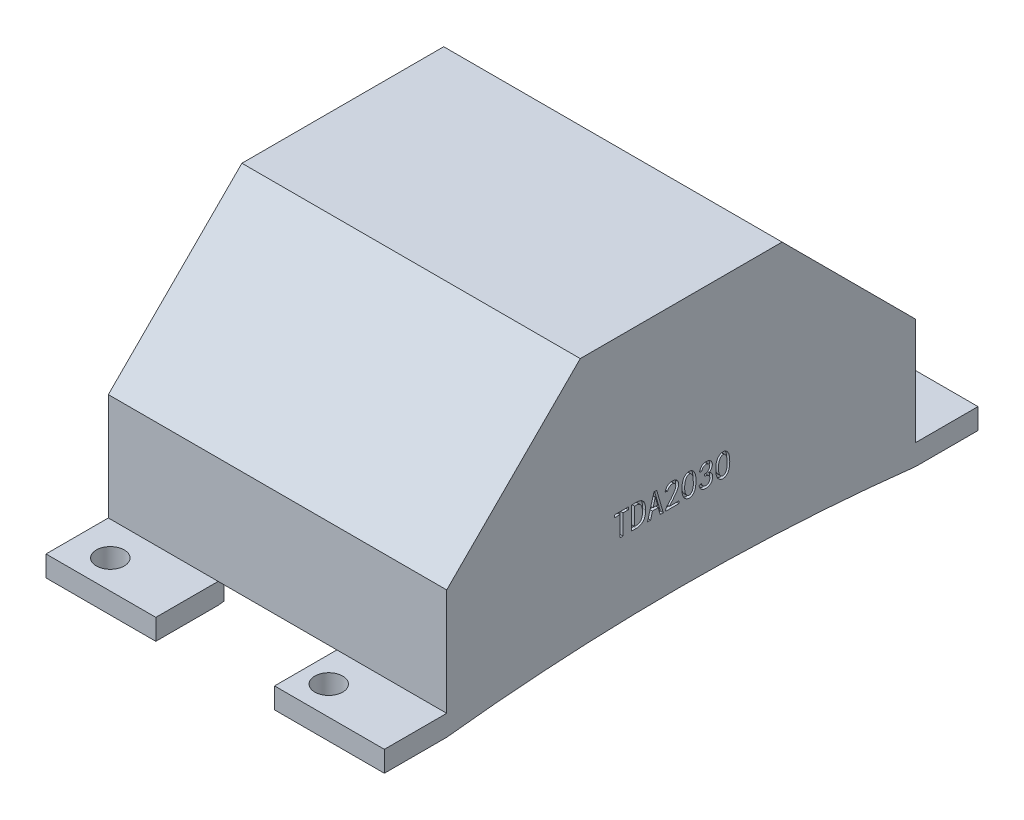
from build123d import *

# Parameters (mm, degrees)
EXTRUDE_1_DEPTH     = 100
SKETCH_2_R          = 2.35
CUT_EXTRUDE_1_DEPTH = 113.90814851
CUT_EXTRUDE_3_DEPTH = 118.187883333
SKETCH_9_W          = 51
SKETCH_9_H          = 77
CUT_EXTRUDE_4_DEPTH = 9
SKETCH_5_W          = 57
SKETCH_5_H          = 18
EXTRUDE_2_DEPTH     = 1
SKETCH_6_W          = 57
SKETCH_6_H          = 31.819805153
EXTRUDE_3_DEPTH     = 1
SKETCH_7_W          = 57
SKETCH_7_H          = 18
EXTRUDE_4_DEPTH     = 1
SKETCH_8_W          = 57
SKETCH_8_H          = 31.819805154
EXTRUDE_5_DEPTH     = 1
CUT_EXTRUDE_5_DEPTH = 0.5


with BuildPart() as part:
    # 草图1 → 凸台-拉伸1 (new body)
    with BuildSketch(Plane.XY):
        Polygon((-10, -18.5), (-10, -22), (-28.5, -22), (-28.5, 22), (28.5, 22), (28.5, -22), (10, -22), (10, -18.5), (25.5, -18.5), (25.5, 20), (-25.5, 20), (-25.5, -18.5), align=None)
    extrude(amount=EXTRUDE_1_DEPTH)

    # 草图2 → 切除-拉伸1 (cut, through all)
    with BuildSketch(Plane.XZ.offset(22)):
        with Locations(Location((-22.5, 95.17, 0), (0, 0, 270))):
            Circle(SKETCH_2_R)
        with Locations(Location((14.3, 95.17, 0), (0, 0, 270))):
            Circle(SKETCH_2_R)
        with Locations(Location((14.3, 4.83, 0), (0, 0, 270))):
            Circle(SKETCH_2_R)
        with Locations(Location((-22.5, 4.83, 0), (0, 0, 270))):
            Circle(SKETCH_2_R)
    extrude(amount=-CUT_EXTRUDE_1_DEPTH, mode=Mode.SUBTRACT)

    # 草图3 → 切除-拉伸3 (cut, through all)
    with BuildSketch(Plane(origin=(28.5, 0, 0), x_dir=(0, 0, -1), z_dir=(1, 0, 0))):
        with BuildLine():
            Line((-89.5, -22), (-10.5, -22))
            ThreePointArc((-10.5, -22), (-50, -19.748443616), (-89.5, -22))
        make_face()
        Polygon((-100, 22), (-67, 22), (-89.5, -0.5), (-89.5, -18.5), (-100, -18.5), align=None)
        Polygon((0, 22), (-33, 22), (-10.5, -0.5), (-10.5, -18.5), (0, -18.5), align=None)
    extrude(amount=-CUT_EXTRUDE_3_DEPTH, mode=Mode.SUBTRACT)

    # 草图9 → 切除-拉伸4 (cut)
    with BuildSketch(Plane.XZ.offset(22)):
        with Locations((0, 50)):
            Rectangle(SKETCH_9_W, SKETCH_9_H)
    extrude(amount=-CUT_EXTRUDE_4_DEPTH, mode=Mode.SUBTRACT)

    # 草图5 → 凸台-拉伸2 (add)
    with BuildSketch(Plane(origin=(0, 0, 10.5), x_dir=(-1, 0, 0), z_dir=(0, 0, -1))):
        with Locations((0, -9.5)):
            Rectangle(SKETCH_5_W, SKETCH_5_H)
    extrude(amount=-EXTRUDE_2_DEPTH)

    # 草图6 → 凸台-拉伸3 (add)
    with BuildSketch(Plane(origin=(0, -5.5, 5.5), x_dir=(1, 0, 0), z_dir=(0, 0.7071067811865498, -0.7071067811865452))):
        with Locations((0, -22.980970389)):
            Rectangle(SKETCH_6_W, SKETCH_6_H)
    extrude(amount=-EXTRUDE_3_DEPTH)

    # 草图7 → 凸台-拉伸4 (add)
    with BuildSketch(Plane.XY.offset(89.5)):
        with Locations((0, -9.5)):
            Rectangle(SKETCH_7_W, SKETCH_7_H)
    extrude(amount=-EXTRUDE_4_DEPTH)

    # 草图8 → 凸台-拉伸5 (add)
    with BuildSketch(Plane(origin=(0, 44.5, 44.5), x_dir=(1, 0, 0), z_dir=(0, 0.7071067811865485, 0.7071067811865467))):
        with Locations((0, -47.72970773)):
            Rectangle(SKETCH_8_W, SKETCH_8_H)
    extrude(amount=-EXTRUDE_5_DEPTH)

    # 草图11 → 切除-拉伸5 (cut)
    # profile 1 of 7: a face of its own
    with BuildSketch(Plane(origin=(28.5, 0, 0), x_dir=(0, 0, -1), z_dir=(1, 0, 0))):
        with BuildLine():
            add(Edge.make_bspline(
                [(-49.859858376, -5.342714269), (-49.857742239, -5.294955358), (-49.853614897, -5.201805772), (-49.841690154, -5.065983168), (-49.827289812, -4.937438516), (-49.808567465, -4.816564935), (-49.785427588, -4.703764752), (-49.75923609, -4.598446801), (-49.728967687, -4.500905762), (-49.684398102, -4.381779592), (-49.617563882, -4.244666812), (-49.521964843, -4.093970043), (-49.410875583, -3.958504245), (-49.30578161, -3.859244023), (-49.214658026, -3.789384215), (-49.141852018, -3.744026504), (-49.065362425, -3.705271755), (-48.984938406, -3.673666443), (-48.900727853, -3.65012353), (-48.812953864, -3.632742045), (-48.721326753, -3.621989594), (-48.626909526, -3.618790607), (-48.53178085, -3.623269771), (-48.438330549, -3.637861626), (-48.34815264, -3.663765899), (-48.261185547, -3.699328374), (-48.177665951, -3.745021747), (-48.097173432, -3.800478984), (-48.020662254, -3.867134279), (-47.947178828, -3.942281104), (-47.878543157, -4.024986166), (-47.815673035, -4.113653315), (-47.758829626, -4.207367964), (-47.708770604, -4.306644238), (-47.663898635, -4.410606732), (-47.626255042, -4.520181468), (-47.595111462, -4.634923281), (-47.560817502, -4.797016218), (-47.530646252, -5.012028303), (-47.509390226, -5.284151394), (-47.504539926, -5.574310829), (-47.511762106, -5.825239334), (-47.525376083, -6.028549312), (-47.540853669, -6.176012569), (-47.561642751, -6.31596101), (-47.585843717, -6.449075841), (-47.616120589, -6.574649154), (-47.651999007, -6.692815497), (-47.690764029, -6.804346816), (-47.736392553, -6.908070748), (-47.786089176, -7.004868166), (-47.842747575, -7.09349914), (-47.90412904, -7.175160832), (-47.971860717, -7.249206105), (-48.046825053, -7.314143391), (-48.126413921, -7.373106155), (-48.212764745, -7.423290107), (-48.303576513, -7.465876078), (-48.397105797, -7.499769084), (-48.492184933, -7.521859543), (-48.587020301, -7.534989222), (-48.682280196, -7.535037256), (-48.777400223, -7.526754844), (-48.871989744, -7.504967491), (-48.967215497, -7.47501224), (-49.060526822, -7.43264984), (-49.15033677, -7.383871664), (-49.234871874, -7.33137169), (-49.311821904, -7.274244191), (-49.381801697, -7.213236728), (-49.445684231, -7.148861528), (-49.502715596, -7.080507458), (-49.552303837, -7.007985247), (-49.607717793, -6.905919885), (-49.667083837, -6.774267931), (-49.728527363, -6.612104346), (-49.778745369, -6.446040119), (-49.811036569, -6.303332528), (-49.832326112, -6.183946714), (-49.844039657, -6.086080066), (-49.854214632, -5.980730467), (-49.860364096, -5.867873371), (-49.864454524, -5.747410932), (-49.866234748, -5.619257333), (-49.86432933, -5.483427486), (-49.861375006, -5.390446767), (-49.859858376, -5.342714269)],
                knots=[0, 0, 0, 0, 1.18043416, 2.302333746, 3.366253517, 4.374302266, 5.321670991, 6.208995316, 7.053297808, 7.84229274, 9.348259463, 10.810477328, 12.240076564, 13.663562249, 14.3695339, 15.072606272, 15.778577923, 16.484387009, 17.202829605, 17.934942377, 18.692112664, 19.478485278, 20.265441384, 21.040673806, 21.808439453, 22.577161074, 23.356320991, 24.155029842, 24.986154494, 25.858111265, 26.748121484, 27.637306138, 28.540117759, 29.452135788, 30.380885827, 31.334339875, 32.310628684, 33.31521083, 35.42407972, 37.666773946, 40.052062172, 42.587025658, 43.863776122, 45.083322308, 46.247467896, 47.357025429, 48.423487632, 49.435172604, 50.405897663, 51.337337341, 52.231284254, 53.090220275, 53.931690991, 54.751583713, 55.562922169, 56.377338113, 57.194202079, 58.024663732, 58.851830165, 59.645552351, 60.431282623, 61.21044254, 61.99312915, 62.783838437, 63.60230231, 64.454612977, 65.309477934, 66.125301685, 66.909862715, 67.67340185, 68.415973016, 69.147238889, 69.868837108, 70.581506411, 72.0124375, 73.431838244, 74.861437481, 76.292961888, 77.042577341, 77.855187732, 78.726196438, 79.655959089, 80.645695907, 81.702690171, 82.820655125, 84, 84, 84, 84], degree=3))
        make_face()
        with BuildLine():
            add(Edge.make_bspline(
                [(-49.39319171, -5.209380936), (-49.398236861, -5.259554537), (-49.408175985, -5.358398276), (-49.416304986, -5.505031033), (-49.418621531, -5.647512932), (-49.416500207, -5.785901586), (-49.408319368, -5.919926226), (-49.394361475, -6.049846219), (-49.374478872, -6.175570371), (-49.350144322, -6.296765278), (-49.320988179, -6.411493874), (-49.286411333, -6.518197399), (-49.247054559, -6.616098541), (-49.203516718, -6.705344772), (-49.155725475, -6.786042635), (-49.102790906, -6.857733884), (-49.046198141, -6.921943635), (-48.984255891, -6.975904331), (-48.920725101, -7.021219669), (-48.855771946, -7.056429262), (-48.79045577, -7.081378798), (-48.724527276, -7.096634024), (-48.658224098, -7.101504921), (-48.591519798, -7.096786751), (-48.524907793, -7.080319099), (-48.458718952, -7.055080111), (-48.394852259, -7.020318079), (-48.334432132, -6.978342752), (-48.278718351, -6.928215224), (-48.227681458, -6.87047356), (-48.181613293, -6.80476059), (-48.139461748, -6.732199739), (-48.102449488, -6.651587482), (-48.058926256, -6.533556765), (-48.015094207, -6.376371472), (-47.976098022, -6.179955026), (-47.953097117, -5.975118274), (-47.94706652, -5.764955826), (-47.950987609, -5.55613346), (-47.955690462, -5.353842382), (-47.966998642, -5.161500653), (-47.980532289, -4.978128858), (-48.003500152, -4.802908293), (-48.045826865, -4.636756714), (-48.105114162, -4.479223587), (-48.165966149, -4.354867225), (-48.224284981, -4.26459851), (-48.270259084, -4.204030797), (-48.321370558, -4.153419213), (-48.375264642, -4.110272536), (-48.433195038, -4.077424076), (-48.494637853, -4.05285265), (-48.559566256, -4.037625541), (-48.626996278, -4.030117345), (-48.694929713, -4.031429879), (-48.761656745, -4.04335347), (-48.826375209, -4.064206179), (-48.889492324, -4.093892544), (-48.949683835, -4.134072223), (-49.007911871, -4.183248402), (-49.063520448, -4.242249163), (-49.118298476, -4.30947322), (-49.16826557, -4.387533464), (-49.214476303, -4.474975607), (-49.255456622, -4.572923146), (-49.292158735, -4.68080919), (-49.325120771, -4.798627882), (-49.352835212, -4.9264501), (-49.375833302, -5.064377726), (-49.387273683, -5.159944783), (-49.39319171, -5.209380936)],
                knots=[0, 0, 0, 0, 1.378198314, 2.715098627, 4.012594964, 5.272602849, 6.497213731, 7.681415101, 8.842769074, 9.975170128, 11.059162755, 12.076494648, 13.038717388, 13.940857576, 14.788360499, 15.598271168, 16.373595835, 17.122768248, 17.838466736, 18.502782022, 19.136468245, 19.744060339, 20.345653328, 20.947246317, 21.563841626, 22.214212994, 22.87852828, 23.546305104, 24.220743313, 24.921956094, 25.648106704, 26.41081768, 27.212668989, 28.069279432, 29.84713992, 31.666334073, 33.537864714, 35.473745168, 37.408579624, 39.246547954, 41.003985019, 42.674193204, 44.272363647, 45.827394737, 47.348405091, 48.867584295, 49.599750274, 50.283750763, 50.94125936, 51.560811542, 52.165388272, 52.754418158, 53.363720025, 53.982318455, 54.604903792, 55.213928724, 55.828148287, 56.458765578, 57.113918044, 57.800421407, 58.537638978, 59.326979919, 60.167286366, 61.066273245, 62.027297208, 63.065989643, 64.179487018, 65.369443928, 66.639232213, 68, 68, 68, 68], degree=3))
        make_face(mode=Mode.SUBTRACT)
    # profile 2 of 7: a face of its own
    with BuildSketch(Plane(origin=(28.5, 0, 0), x_dir=(0, 0, -1), z_dir=(1, 0, 0))):
        with BuildLine():
            add(Edge.make_bspline(
                [(-44.170969487, -5.342714269), (-44.16885335, -5.294955358), (-44.164726009, -5.201805772), (-44.152801265, -5.065983168), (-44.138400923, -4.937438516), (-44.119678576, -4.816564935), (-44.096538699, -4.703764752), (-44.070347201, -4.598446801), (-44.040078798, -4.500905762), (-43.995509213, -4.381779592), (-43.928674993, -4.244666812), (-43.833075954, -4.093970043), (-43.721986694, -3.958504245), (-43.616892721, -3.859244023), (-43.525769137, -3.789384215), (-43.452963129, -3.744026504), (-43.376473536, -3.705271755), (-43.296049517, -3.673666443), (-43.211838964, -3.65012353), (-43.124064976, -3.632742045), (-43.032437864, -3.621989594), (-42.938020637, -3.618790607), (-42.842891962, -3.623269771), (-42.74944166, -3.637861626), (-42.659263751, -3.663765899), (-42.572296658, -3.699328374), (-42.488777062, -3.745021747), (-42.408284544, -3.800478984), (-42.331773365, -3.867134279), (-42.258289939, -3.942281104), (-42.189654268, -4.024986166), (-42.126784146, -4.113653315), (-42.069940737, -4.207367964), (-42.019881715, -4.306644238), (-41.975009746, -4.410606732), (-41.937366154, -4.520181468), (-41.906222573, -4.634923281), (-41.871928613, -4.797016218), (-41.841757363, -5.012028303), (-41.820501337, -5.284151394), (-41.815651037, -5.574310829), (-41.822873218, -5.825239334), (-41.836487194, -6.028549312), (-41.85196478, -6.176012569), (-41.872753862, -6.31596101), (-41.896954828, -6.449075841), (-41.9272317, -6.574649154), (-41.963110119, -6.692815497), (-42.00187514, -6.804346816), (-42.047503664, -6.908070748), (-42.097200287, -7.004868166), (-42.153858686, -7.09349914), (-42.215240151, -7.175160832), (-42.282971828, -7.249206105), (-42.357936164, -7.314143391), (-42.437525032, -7.373106155), (-42.523875856, -7.423290107), (-42.614687624, -7.465876078), (-42.708216908, -7.499769084), (-42.803296044, -7.521859543), (-42.898131412, -7.534989222), (-42.993391307, -7.535037256), (-43.088511334, -7.526754844), (-43.183100855, -7.504967491), (-43.278326608, -7.47501224), (-43.371637933, -7.43264984), (-43.461447881, -7.383871664), (-43.545982985, -7.33137169), (-43.622933015, -7.274244191), (-43.692912808, -7.213236728), (-43.756795343, -7.148861528), (-43.813826708, -7.080507458), (-43.863414948, -7.007985247), (-43.918828904, -6.905919885), (-43.978194948, -6.774267931), (-44.039638474, -6.612104346), (-44.08985648, -6.446040119), (-44.12214768, -6.303332528), (-44.143437223, -6.183946714), (-44.155150768, -6.086080066), (-44.165325744, -5.980730467), (-44.171475207, -5.867873371), (-44.175565636, -5.747410932), (-44.177345859, -5.619257333), (-44.175440441, -5.483427486), (-44.172486117, -5.390446767), (-44.170969487, -5.342714269)],
                knots=[0, 0, 0, 0, 1.18043416, 2.302333746, 3.366253517, 4.374302266, 5.321670991, 6.208995316, 7.053297808, 7.84229274, 9.348259463, 10.810477328, 12.240076564, 13.663562249, 14.3695339, 15.072606272, 15.778577923, 16.484387009, 17.202829605, 17.934942377, 18.692112664, 19.478485278, 20.265441384, 21.040673806, 21.808439453, 22.577161074, 23.356320991, 24.155029842, 24.986154494, 25.858111265, 26.748121484, 27.637306138, 28.540117759, 29.452135788, 30.380885827, 31.334339875, 32.310628684, 33.31521083, 35.42407972, 37.666773946, 40.052062172, 42.587025658, 43.863776122, 45.083322308, 46.247467896, 47.357025429, 48.423487632, 49.435172604, 50.405897663, 51.337337341, 52.231284254, 53.090220275, 53.931690991, 54.751583713, 55.562922169, 56.377338113, 57.194202079, 58.024663732, 58.851830165, 59.645552351, 60.431282623, 61.21044254, 61.99312915, 62.783838437, 63.60230231, 64.454612977, 65.309477934, 66.125301685, 66.909862715, 67.67340185, 68.415973016, 69.147238889, 69.868837108, 70.581506411, 72.0124375, 73.431838244, 74.861437481, 76.292961888, 77.042577341, 77.855187732, 78.726196438, 79.655959089, 80.645695907, 81.702690171, 82.820655125, 84, 84, 84, 84], degree=3))
        make_face()
        with BuildLine():
            add(Edge.make_bspline(
                [(-43.704302821, -5.209380936), (-43.709347972, -5.259554537), (-43.719287096, -5.358398276), (-43.727416097, -5.505031033), (-43.729732642, -5.647512932), (-43.727611318, -5.785901586), (-43.719430479, -5.919926226), (-43.705472586, -6.049846219), (-43.685589983, -6.175570371), (-43.661255433, -6.296765278), (-43.63209929, -6.411493874), (-43.597522444, -6.518197399), (-43.55816567, -6.616098541), (-43.514627829, -6.705344772), (-43.466836587, -6.786042635), (-43.413902017, -6.857733884), (-43.357309252, -6.921943635), (-43.295367002, -6.975904331), (-43.231836212, -7.021219669), (-43.166883057, -7.056429262), (-43.101566881, -7.081378798), (-43.035638387, -7.096634024), (-42.969335209, -7.101504921), (-42.90263091, -7.096786751), (-42.836018904, -7.080319099), (-42.769830064, -7.055080111), (-42.70596337, -7.020318079), (-42.645543244, -6.978342752), (-42.589829462, -6.928215224), (-42.538792569, -6.87047356), (-42.492724404, -6.80476059), (-42.450572859, -6.732199739), (-42.413560599, -6.651587482), (-42.370037367, -6.533556765), (-42.326205318, -6.376371472), (-42.287209133, -6.179955026), (-42.264208228, -5.975118274), (-42.258177631, -5.764955826), (-42.26209872, -5.55613346), (-42.266801573, -5.353842382), (-42.278109753, -5.161500653), (-42.2916434, -4.978128858), (-42.314611263, -4.802908293), (-42.356937976, -4.636756714), (-42.416225274, -4.479223587), (-42.47707726, -4.354867225), (-42.535396093, -4.26459851), (-42.581370196, -4.204030797), (-42.632481669, -4.153419213), (-42.686375753, -4.110272536), (-42.744306149, -4.077424076), (-42.805748964, -4.05285265), (-42.870677367, -4.037625541), (-42.938107389, -4.030117345), (-43.006040824, -4.031429879), (-43.072767856, -4.04335347), (-43.13748632, -4.064206179), (-43.200603435, -4.093892544), (-43.260794947, -4.134072223), (-43.319022982, -4.183248402), (-43.374631559, -4.242249163), (-43.429409587, -4.30947322), (-43.479376681, -4.387533464), (-43.525587414, -4.474975607), (-43.566567733, -4.572923146), (-43.603269846, -4.68080919), (-43.636231882, -4.798627882), (-43.663946324, -4.9264501), (-43.686944413, -5.064377726), (-43.698384794, -5.159944783), (-43.704302821, -5.209380936)],
                knots=[0, 0, 0, 0, 1.378198314, 2.715098627, 4.012594964, 5.272602849, 6.497213731, 7.681415101, 8.842769074, 9.975170128, 11.059162755, 12.076494648, 13.038717388, 13.940857576, 14.788360499, 15.598271168, 16.373595835, 17.122768248, 17.838466736, 18.502782022, 19.136468245, 19.744060339, 20.345653328, 20.947246317, 21.563841626, 22.214212994, 22.87852828, 23.546305104, 24.220743313, 24.921956094, 25.648106704, 26.41081768, 27.212668989, 28.069279432, 29.84713992, 31.666334073, 33.537864714, 35.473745168, 37.408579624, 39.246547954, 41.003985019, 42.674193204, 44.272363647, 45.827394737, 47.348405091, 48.867584295, 49.599750274, 50.283750763, 50.94125936, 51.560811542, 52.165388272, 52.754418158, 53.363720025, 53.982318455, 54.604903792, 55.213928724, 55.828148287, 56.458765578, 57.113918044, 57.800421407, 58.537638978, 59.326979919, 60.167286366, 61.066273245, 62.027297208, 63.065989643, 64.179487018, 65.369443928, 66.639232213, 68, 68, 68, 68], degree=3))
        make_face(mode=Mode.SUBTRACT)
    # profile 3 of 7: a face of its own
    with BuildSketch(Plane(origin=(28.5, 0, 0), x_dir=(0, 0, -1), z_dir=(1, 0, 0))):
        Polygon((-58.904302821, -4.108969413), (-59.79319171, -4.108969413), (-59.79319171, -7.486747191), (-60.304302821, -7.486747191), (-60.304302821, -4.108969413), (-61.19319171, -4.108969413), (-61.19319171, -3.686747191), (-58.904302821, -3.686747191), align=None)
    # profile 4 of 7: a face of its own
    with BuildSketch(Plane(origin=(28.5, 0, 0), x_dir=(0, 0, -1), z_dir=(1, 0, 0))):
        with BuildLine():
            add(Edge.make_bspline(
                [(-55.99319171, -5.597858302), (-55.994269864, -5.67993886), (-55.996350544, -5.838342359), (-56.017420637, -6.066806622), (-56.050051903, -6.277247458), (-56.097746545, -6.46925014), (-56.15835103, -6.643146149), (-56.232045348, -6.799240816), (-56.32058307, -6.936829703), (-56.423680199, -7.05508731), (-56.53786849, -7.157065654), (-56.661078714, -7.24535477), (-56.793091324, -7.321069909), (-56.935532158, -7.380816362), (-57.086329489, -7.429043453), (-57.247178934, -7.46215567), (-57.41703562, -7.483431206), (-57.533591421, -7.485625268), (-57.59319171, -7.486747191)],
                knots=[0, 0, 0, 0, 1.389524785, 2.681580087, 3.881416849, 4.992360851, 6.026729756, 6.995017906, 7.908603538, 8.787894915, 9.643211222, 10.495393011, 11.350494818, 12.214247491, 13.106065295, 14.027214329, 14.991224842, 16, 16, 16, 16], degree=3))
            Line((-57.59319171, -7.486747191), (-58.348747265, -7.486747191))
            Line((-58.348747265, -7.486747191), (-58.348747265, -3.686747191))
            Line((-58.348747265, -3.686747191), (-57.59319171, -3.686747191))
            add(Edge.make_bspline(
                [(-57.59319171, -3.686747191), (-57.526730958, -3.687757535), (-57.398100957, -3.689712982), (-57.212343826, -3.71189123), (-57.039964574, -3.74570702), (-56.880997109, -3.79428314), (-56.73511419, -3.856549024), (-56.603310656, -3.933879626), (-56.483999009, -4.02376551), (-56.379273467, -4.130056216), (-56.286679451, -4.25173147), (-56.207612133, -4.391446863), (-56.141597308, -4.548930419), (-56.085971161, -4.723668123), (-56.04515293, -4.917074481), (-56.015250446, -5.127972019), (-55.995691988, -5.356889715), (-55.994046138, -5.515511314), (-55.99319171, -5.597858302)],
                knots=[0, 0, 0, 0, 1.107739609, 2.143950281, 3.114742919, 4.033667788, 4.910720376, 5.753428295, 6.576026955, 7.394480551, 8.23354201, 9.118765776, 10.063698003, 11.076506874, 12.172173314, 13.355526632, 14.627145244, 16, 16, 16, 16], degree=3))
        make_face()
        with BuildLine():
            add(Edge.make_bspline(
                [(-56.526525043, -5.597858302), (-56.527285369, -5.531998443), (-56.528750447, -5.405092555), (-56.540705314, -5.222026487), (-56.562284333, -5.054225172), (-56.589976957, -4.901225291), (-56.628081652, -4.764291164), (-56.672688364, -4.641884136), (-56.727098911, -4.534887928), (-56.790107009, -4.442101235), (-56.862076947, -4.362897772), (-56.941974253, -4.294530589), (-57.03034127, -4.236999332), (-57.126927352, -4.189348749), (-57.231977107, -4.153755225), (-57.344897491, -4.127121856), (-57.466275245, -4.11144517), (-57.550072792, -4.109810533), (-57.59319171, -4.108969413)],
                knots=[0, 0, 0, 0, 1.50261862, 2.895407767, 4.182685949, 5.361245188, 6.439488336, 7.421939034, 8.328969596, 9.171036484, 9.973163414, 10.763455177, 11.563821661, 12.37285522, 13.214177287, 14.088724386, 15.01653284, 16, 16, 16, 16], degree=3))
            Line((-57.59319171, -4.108969413), (-57.837636154, -4.108969413))
            Line((-57.837636154, -4.108969413), (-57.837636154, -7.064524969))
            Line((-57.837636154, -7.064524969), (-57.59319171, -7.064524969))
            add(Edge.make_bspline(
                [(-57.59319171, -7.064524969), (-57.550080301, -7.063606844), (-57.46633161, -7.061823284), (-57.344946525, -7.047216639), (-57.232001831, -7.02141316), (-57.127153774, -6.986503255), (-57.030635059, -6.940591969), (-56.942078806, -6.885639842), (-56.862118227, -6.819756782), (-56.790444249, -6.743090519), (-56.726600146, -6.653280546), (-56.672781692, -6.548054122), (-56.627883137, -6.427125611), (-56.590113737, -6.291446889), (-56.562249123, -6.139863333), (-56.540612857, -5.973151116), (-56.52876657, -5.790622779), (-56.527290878, -5.663717728), (-56.526525043, -5.597858302)],
                knots=[0, 0, 0, 0, 0.9908866, 1.924907101, 2.80462885, 3.650254363, 4.45990781, 5.256111711, 6.040209073, 6.834462288, 7.662189065, 8.564851509, 9.54291023, 10.623211397, 11.798270521, 13.082748796, 14.486045376, 16, 16, 16, 16], degree=3))
        make_face(mode=Mode.SUBTRACT)
    # profile 5 of 7: a face of its own
    with BuildSketch(Plane(origin=(28.5, 0, 0), x_dir=(0, 0, -1), z_dir=(1, 0, 0))):
        Polygon((-53.015413932, -7.486747191), (-53.548747265, -7.486747191), (-53.859858376, -6.308969413), (-54.837636154, -6.308969413), (-55.148747265, -7.486747191), (-55.682080599, -7.486747191), (-54.570969487, -3.642302747), (-54.126525043, -3.642302747), align=None)
        Polygon((-53.970969487, -5.886747191), (-54.326525043, -4.531191636), (-54.370969487, -4.531191636), (-54.726525043, -5.886747191), align=None, mode=Mode.SUBTRACT)
    # profile 6 of 7: a face of its own
    with BuildSketch(Plane(origin=(28.5, 0, 0), x_dir=(0, 0, -1), z_dir=(1, 0, 0))):
        with BuildLine():
            add(Edge.make_bspline(
                [(-52.637636154, -7.37563608), (-52.634947977, -7.348110065), (-52.629605088, -7.293400715), (-52.610843987, -7.212916123), (-52.584445741, -7.13433463), (-52.549715845, -7.057691464), (-52.506833329, -6.982955565), (-52.454086772, -6.91170925), (-52.395185936, -6.84081236), (-52.324745649, -6.773802522), (-52.248795372, -6.702503959), (-52.170127216, -6.620893882), (-52.084918682, -6.531795453), (-51.996622329, -6.431411615), (-51.901510066, -6.323352235), (-51.80324043, -6.204424541), (-51.699466346, -6.076903156), (-51.593100014, -5.943159057), (-51.488864669, -5.808829525), (-51.39280892, -5.678644179), (-51.305453974, -5.557087049), (-51.227504802, -5.44372899), (-51.161038449, -5.337264087), (-51.103318822, -5.239344478), (-51.054068668, -5.150147228), (-51.004921795, -5.043616023), (-50.958536945, -4.92075753), (-50.922166236, -4.781186689), (-50.905638839, -4.652015768), (-50.912136147, -4.533316343), (-50.937650493, -4.424994729), (-50.982228444, -4.326721699), (-51.044786868, -4.238148187), (-51.124767871, -4.162585456), (-51.215936526, -4.100374851), (-51.317391206, -4.058575894), (-51.425946754, -4.037451721), (-51.539515917, -4.0393629), (-51.653989432, -4.059714881), (-51.768029512, -4.095090258), (-51.877965288, -4.149864677), (-51.985666961, -4.218197813), (-52.085453564, -4.306231547), (-52.173160504, -4.414641474), (-52.247771307, -4.542875335), (-52.284994822, -4.637608623), (-52.304302821, -4.686747191)],
                knots=[0, 0, 0, 0, 0.683264685, 1.358023177, 2.0380809, 2.730345762, 3.435487858, 4.164189287, 4.919895072, 5.711413948, 6.565494804, 7.49616148, 8.513531843, 9.613812574, 10.80147361, 12.073102873, 13.428218159, 14.866997124, 16.298560904, 17.632315587, 18.867297526, 20.000038836, 21.033387935, 21.969994494, 22.810824564, 23.551397478, 24.869445784, 26.052467085, 27.111050094, 28.075902372, 28.975949733, 29.847314516, 30.728213316, 31.639844513, 32.554273251, 33.442456201, 34.333871785, 35.270085163, 36.233696473, 37.201335111, 38.211692251, 39.261697588, 40.347896805, 41.485826765, 42.695887429, 44, 44, 44, 44], degree=3))
            Line((-52.304302821, -4.686747191), (-52.726525043, -4.620080525))
            add(Edge.make_bspline(
                [(-52.726525043, -4.620080525), (-52.711618023, -4.578749359), (-52.682615437, -4.498336867), (-52.632674, -4.383833372), (-52.58108332, -4.277245504), (-52.526427332, -4.179279498), (-52.467520304, -4.090634636), (-52.405791003, -4.010449114), (-52.340964378, -3.938733676), (-52.272791199, -3.875572205), (-52.20150558, -3.8198923), (-52.126617984, -3.771604893), (-52.049060879, -3.729424552), (-51.968529181, -3.693626713), (-51.884848993, -3.664777173), (-51.797648243, -3.64379741), (-51.707818835, -3.627521312), (-51.646479206, -3.622582016), (-51.615413932, -3.620080525)],
                knots=[0, 0, 0, 0, 1.318688324, 2.565594597, 3.747971738, 4.872722892, 5.930337296, 6.940181326, 7.908044283, 8.828858542, 9.726735078, 10.619953387, 11.500744836, 12.374616489, 13.262770363, 14.15366946, 15.064931369, 16, 16, 16, 16], degree=3))
            add(Edge.make_bspline(
                [(-51.615413932, -3.620080525), (-51.579225653, -3.617178092), (-51.508846455, -3.611533421), (-51.405692106, -3.610470616), (-51.308342699, -3.6172034), (-51.215075769, -3.629990175), (-51.123958827, -3.65259423), (-51.032644651, -3.685948199), (-50.940269681, -3.731029788), (-50.846984149, -3.786322884), (-50.755542461, -3.854009568), (-50.672756251, -3.939121903), (-50.599700843, -4.040012027), (-50.534427683, -4.15414327), (-50.48174168, -4.282461245), (-50.450056326, -4.425388097), (-50.438437331, -4.580429765), (-50.444821644, -4.717186884), (-50.460373426, -4.832909206), (-50.482163174, -4.925396608), (-50.51356588, -5.021676186), (-50.550539103, -5.123239166), (-50.599635518, -5.227677062), (-50.654897071, -5.337231714), (-50.720981155, -5.449916911), (-50.780951979, -5.547271328), (-50.835286201, -5.628329947), (-50.880795857, -5.694474356), (-50.930512614, -5.765080447), (-50.986315545, -5.839025598), (-51.0452505, -5.918005273), (-51.108645322, -6.001337224), (-51.177051812, -6.088298995), (-51.249678695, -6.179992763), (-51.326853902, -6.276174), (-51.408925749, -6.376285326), (-51.495871567, -6.480101607), (-51.586338361, -6.58902965), (-51.681427721, -6.702156452), (-51.781212467, -6.819375421), (-51.886022149, -6.940158354), (-51.957002343, -7.022528446), (-51.99319171, -7.064524969)],
                knots=[0, 0, 0, 0, 0.924262298, 1.797511285, 2.623724224, 3.407158757, 4.191620419, 5.009283641, 5.877881841, 6.805175164, 7.767818098, 8.765683208, 9.814991193, 10.931884262, 12.107176208, 13.332417047, 14.642951659, 16.055476784, 16.810263112, 17.613474593, 18.470705512, 19.388078144, 20.363412498, 21.406914204, 22.511682051, 23.688322701, 24.318011351, 24.996206783, 25.732766533, 26.516574724, 27.354866926, 28.242087009, 29.182574856, 30.172115786, 31.220563025, 32.322544456, 33.468316952, 34.668650042, 35.928027342, 37.231299145, 38.588373428, 40, 40, 40, 40], degree=3))
            Line((-51.99319171, -7.064524969), (-50.39319171, -7.064524969))
            Line((-50.39319171, -7.064524969), (-50.39319171, -7.464524969))
            Line((-50.39319171, -7.464524969), (-52.637636154, -7.464524969))
            Line((-52.637636154, -7.464524969), (-52.637636154, -7.37563608))
        make_face()
    # profile 7 of 7: a face of its own
    with BuildSketch(Plane(origin=(28.5, 0, 0), x_dir=(0, 0, -1), z_dir=(1, 0, 0))):
        with BuildLine():
            Line((-46.99319171, -6.508969413), (-46.59319171, -6.442302747))
            add(Edge.make_bspline(
                [(-46.59319171, -6.442302747), (-46.577424515, -6.488900038), (-46.546455619, -6.580423399), (-46.479539626, -6.706822258), (-46.399558372, -6.820870634), (-46.322825339, -6.906278949), (-46.253466944, -6.964602328), (-46.198762355, -7.0027676), (-46.141270305, -7.035508772), (-46.079370239, -7.059530797), (-46.015344169, -7.080202297), (-45.947464566, -7.091805311), (-45.877036781, -7.098434524), (-45.804570617, -7.09957475), (-45.732344791, -7.092971864), (-45.662592689, -7.079771778), (-45.596418258, -7.06025846), (-45.534097665, -7.033007412), (-45.476510917, -6.997695651), (-45.421439754, -6.957539144), (-45.371001133, -6.909263627), (-45.325677612, -6.854345478), (-45.284685638, -6.795395252), (-45.249259623, -6.733796957), (-45.219995194, -6.669963325), (-45.198131936, -6.6038688), (-45.181127762, -6.535988867), (-45.171743825, -6.465894849), (-45.167244089, -6.393781607), (-45.170190598, -6.320572706), (-45.17764477, -6.248286737), (-45.192872391, -6.179194597), (-45.213356531, -6.114514998), (-45.238782641, -6.053031775), (-45.271909321, -5.99686014), (-45.310051297, -5.944320155), (-45.354022939, -5.896055854), (-45.404894638, -5.852338619), (-45.462148321, -5.811757492), (-45.527049983, -5.774283237), (-45.600510209, -5.741367662), (-45.680976544, -5.709637159), (-45.770094213, -5.6829046), (-45.866715467, -5.658313588), (-45.971626817, -5.636804681), (-46.044437855, -5.625780131), (-46.082080599, -5.620080525)],
                knots=[0, 0, 0, 0, 1.854799748, 3.643076762, 5.375778243, 7.105784308, 7.958514958, 8.791774595, 9.621744654, 10.44880128, 11.294076632, 12.157496915, 13.041787632, 13.96367637, 14.889223527, 15.774908308, 16.640004354, 17.48869958, 18.334228731, 19.185637365, 20.057465777, 20.961908388, 21.86984341, 22.765285775, 23.641349219, 24.5158806, 25.390105247, 26.279235462, 27.181837661, 28.114543598, 29.042174801, 29.921843334, 30.780091711, 31.601551697, 32.427634894, 33.235597725, 34.049381879, 34.886366892, 35.762920031, 36.695625967, 37.710569643, 38.799256358, 39.959035312, 41.220118669, 42.562822875, 44, 44, 44, 44], degree=3))
            Line((-46.082080599, -5.620080525), (-46.082080599, -5.331191636))
            add(Edge.make_bspline(
                [(-46.082080599, -5.331191636), (-46.044418206, -5.327346045), (-45.971514102, -5.319902032), (-45.866748321, -5.300184202), (-45.769723875, -5.277977866), (-45.680866649, -5.249762404), (-45.599880178, -5.216886968), (-45.526441058, -5.179531968), (-45.461453991, -5.136191194), (-45.404444663, -5.088302579), (-45.354592144, -5.036241967), (-45.312527924, -4.980019382), (-45.277454355, -4.920225132), (-45.250070439, -4.856344392), (-45.230760877, -4.788503886), (-45.216903836, -4.717218011), (-45.212814045, -4.642070201), (-45.214260931, -4.564718721), (-45.222538563, -4.488125483), (-45.240165261, -4.415540415), (-45.264981709, -4.348417902), (-45.29665596, -4.286067648), (-45.338057829, -4.230483313), (-45.385882964, -4.179861819), (-45.441639957, -4.135203716), (-45.504002311, -4.096848763), (-45.570748044, -4.065523311), (-45.639057077, -4.040017545), (-45.708924869, -4.024717341), (-45.779488342, -4.016414623), (-45.851326288, -4.015117341), (-45.92408535, -4.024076637), (-45.997989235, -4.039771109), (-46.072532296, -4.063323425), (-46.14669127, -4.096549882), (-46.216240435, -4.144533455), (-46.281278504, -4.20477014), (-46.344049982, -4.276133241), (-46.400601814, -4.361671568), (-46.455243427, -4.458258284), (-46.505649627, -4.567539957), (-46.533982435, -4.645907957), (-46.548747265, -4.686747191)],
                knots=[0, 0, 0, 0, 1.385117707, 2.68120955, 3.899080185, 5.026526245, 6.089471502, 7.095537128, 8.036926677, 8.942108935, 9.815771246, 10.669349366, 11.506404864, 12.347666396, 13.205663414, 14.084102859, 14.999917747, 15.954128211, 16.914501223, 17.813254747, 18.680661639, 19.529560311, 20.363114732, 21.208382436, 22.07252795, 22.96987783, 23.881720011, 24.767988279, 25.632833695, 26.492298631, 27.366018653, 28.255410494, 29.169296362, 30.128408489, 31.112431375, 32.1318401, 33.205217515, 34.351116983, 35.601710711, 36.950682265, 38.410935554, 40, 40, 40, 40], degree=3))
            Line((-46.548747265, -4.686747191), (-46.948747265, -4.620080525))
            add(Edge.make_bspline(
                [(-46.948747265, -4.620080525), (-46.925430121, -4.555716764), (-46.879994563, -4.430298178), (-46.79509027, -4.253939567), (-46.696553195, -4.095002383), (-46.604179789, -3.975047178), (-46.523045035, -3.888898715), (-46.455762653, -3.833365938), (-46.384439833, -3.782893514), (-46.307211715, -3.740665166), (-46.224994255, -3.704649251), (-46.13738138, -3.677097125), (-46.044924039, -3.655659977), (-45.948582221, -3.641114019), (-45.851505143, -3.633406503), (-45.756117752, -3.630273386), (-45.663811597, -3.635075792), (-45.574291993, -3.643244817), (-45.488286663, -3.659374693), (-45.405287538, -3.680490992), (-45.325814976, -3.708907402), (-45.248949652, -3.741346791), (-45.177128324, -3.780144089), (-45.109479567, -3.822632626), (-45.048940042, -3.871962171), (-44.991976325, -3.924108113), (-44.943072893, -3.983421235), (-44.897914895, -4.046324183), (-44.858539629, -4.114310382), (-44.825904055, -4.187059177), (-44.798644596, -4.262394697), (-44.778246062, -4.340416626), (-44.763027139, -4.419820294), (-44.755886735, -4.501406159), (-44.755051066, -4.584236413), (-44.76097366, -4.668978566), (-44.773488643, -4.755316151), (-44.792016961, -4.843029405), (-44.818681399, -4.93068912), (-44.857075842, -5.015943919), (-44.905875488, -5.098311246), (-44.96498939, -5.177912077), (-45.034324227, -5.254669132), (-45.114912652, -5.327618421), (-45.204806849, -5.399045518), (-45.270471437, -5.442260144), (-45.304302821, -5.464524969)],
                knots=[0, 0, 0, 0, 2.088435488, 4.069504719, 5.960900737, 7.786563479, 8.680771598, 9.566313178, 10.444341104, 11.343825986, 12.247587673, 13.179685867, 14.142420713, 15.141886465, 16.150152099, 17.113396579, 18.05212794, 18.969441419, 19.854666253, 20.719823891, 21.58047219, 22.428151748, 23.263500765, 24.069461113, 24.861911808, 25.643808195, 26.422154676, 27.202794716, 28.005617324, 28.815006474, 29.633397489, 30.44783822, 31.273903418, 32.097929155, 32.94366283, 33.799737089, 34.68784804, 35.604243899, 36.533818883, 37.478357806, 38.450549751, 39.450331118, 40.49965591, 41.60193164, 42.764479089, 44, 44, 44, 44], degree=3))
            add(Edge.make_bspline(
                [(-45.304302821, -5.464524969), (-45.254650137, -5.48802465), (-45.157444085, -5.534030444), (-45.027457252, -5.627104486), (-44.915869722, -5.736845464), (-44.838641552, -5.841883549), (-44.786453543, -5.933486606), (-44.755386338, -6.008778379), (-44.73163584, -6.089128354), (-44.714473699, -6.174239959), (-44.703580916, -6.264500754), (-44.700852938, -6.360004801), (-44.704039334, -6.460923841), (-44.714773627, -6.565128032), (-44.731933808, -6.669733954), (-44.759470795, -6.770453327), (-44.794684402, -6.866178694), (-44.838726535, -6.957086521), (-44.891957973, -7.042382711), (-44.954825645, -7.121893436), (-45.024526527, -7.197376815), (-45.103600217, -7.265616305), (-45.187377431, -7.327785232), (-45.275298911, -7.381644026), (-45.365781555, -7.427079174), (-45.459179309, -7.463514323), (-45.555424589, -7.490740793), (-45.654299078, -7.509546439), (-45.756149848, -7.5205561), (-45.859677544, -7.521729056), (-45.962936945, -7.515573625), (-46.063461803, -7.500135751), (-46.160953124, -7.479548163), (-46.25453562, -7.449063786), (-46.345279018, -7.412637789), (-46.431571669, -7.366821111), (-46.514845605, -7.314536276), (-46.594264, -7.254981189), (-46.668628644, -7.187392442), (-46.736241188, -7.111997722), (-46.797729294, -7.029821683), (-46.849739184, -6.939001205), (-46.897681517, -6.842496705), (-46.9362407, -6.737636061), (-46.970015246, -6.626224609), (-46.98535093, -6.548637769), (-46.99319171, -6.508969413)],
                knots=[0, 0, 0, 0, 1.556863988, 3.047903747, 4.51274202, 5.983117829, 6.732724558, 7.500714565, 8.289161914, 9.10779992, 9.96267821, 10.866591561, 11.817204889, 12.826910154, 13.838355827, 14.822602624, 15.786048742, 16.729939345, 17.685039949, 18.633769323, 19.603521256, 20.596937443, 21.593797024, 22.562140776, 23.519904659, 24.464277043, 25.403497682, 26.355035653, 27.318261422, 28.307425488, 29.290655039, 30.251043242, 31.192037974, 32.115630974, 33.041191859, 33.964292232, 34.884727864, 35.830159304, 36.778345149, 37.732302073, 38.701115445, 39.685485474, 40.699027657, 41.756353326, 42.852875359, 44, 44, 44, 44], degree=3))
        make_face()
    extrude(amount=-CUT_EXTRUDE_5_DEPTH, mode=Mode.SUBTRACT)


solid = part.part
